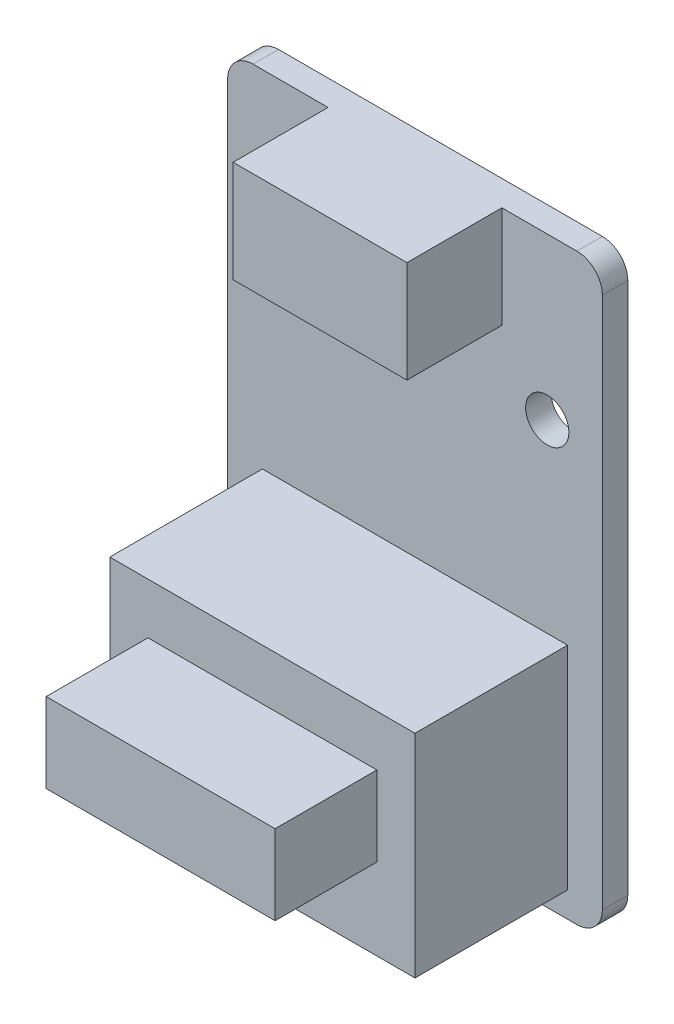
from build123d import *

# Parameters (mm, degrees)
EXTRUDE_1_DEPTH      = 1.5
SKETCH_2_W           = 18
SKETCH_2_H           = 12.5
EXTRUDE_2_DEPTH      = 9
SKETCH_3_W           = 13.5
SKETCH_3_H           = 4.7
EXTRUDE_3_DEPTH      = 6
SKETCH_4_W           = 10.25
SKETCH_4_H           = 6
EXTRUDE_4_DEPTH      = 5.6
HOLE_WIZARD_M2_5_1_D = 2.55


with BuildPart() as part:
    # 草圖1 → 填料-伸長1 (new body)
    with BuildSketch(Plane.XY):
        with BuildLine():
            Line((-6.760595539, -58.744235659), (12.339404461, -58.744235659))
            ThreePointArc((12.339404461, -58.744235659), (13.400064632, -59.183575487), (13.839404461, -60.244235659))
            Line((13.839404461, -60.244235659), (13.839404461, -91.644235659))
            ThreePointArc((13.839404461, -91.644235659), (13.400064632, -92.70489583), (12.339404461, -93.144235659))
            Line((12.339404461, -93.144235659), (-6.760595539, -93.144235659))
            ThreePointArc((-6.760595539, -93.144235659), (-7.821255711, -92.70489583), (-8.260595539, -91.644235659))
            Line((-8.260595539, -91.644235659), (-8.260595539, -60.244235659))
            ThreePointArc((-8.260595539, -60.244235659), (-7.821255711, -59.183575487), (-6.760595539, -58.744235659))
        make_face()
    extrude(amount=EXTRUDE_1_DEPTH)

    # 草圖2 → 填料-伸長2 (add)
    with BuildSketch(Plane.XY.offset(1.5)):
        with Locations((2.789404461, -85.394235659)):
            Rectangle(SKETCH_2_W, SKETCH_2_H)
    extrude(amount=EXTRUDE_2_DEPTH)

    # 草圖3 → 填料-伸長3 (add)
    with BuildSketch(Plane.XY.offset(10.5)):
        with Locations((2.789404461, -84.494235659)):
            Rectangle(SKETCH_3_W, SKETCH_3_H)
    extrude(amount=EXTRUDE_3_DEPTH)

    # 草圖4 → 填料-伸長4 (add)
    with BuildSketch(Plane.XY.offset(1.5)):
        with Locations((2.789404461, -61.744235659)):
            Rectangle(SKETCH_4_W, SKETCH_4_H)
    extrude(amount=EXTRUDE_4_DEPTH)

    # M2.5 螺旋的螺孔鑽1 (through all)
    with Locations(Plane.XY.offset(1.5)):
        with Locations((-5.010595539, -68.244235659), (10.589404461, -68.244235659)):
            Hole(HOLE_WIZARD_M2_5_1_D / 2)


solid = part.part
